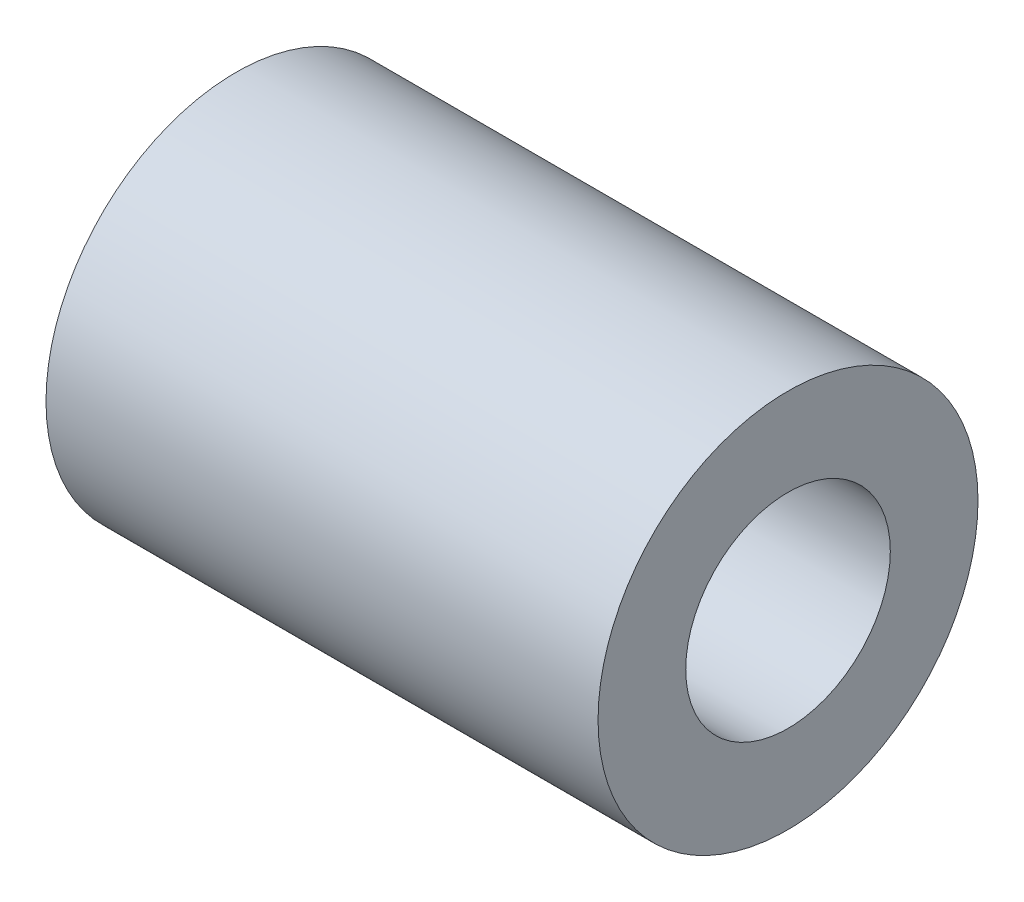
from build123d import *

# Parameters (mm, degrees)
SKETCH1_R           = 5.85
SKETCH1_R_2         = 3.15
BOSS_EXTRUDE1_DEPTH = 17


with BuildPart() as part:
    # Sketch1 → Boss-Extrude1 (new body)
    with BuildSketch(Plane(origin=(0, 0, 0), x_dir=(0, 0, -1), z_dir=(1, 0, 0))):
        Circle(SKETCH1_R)
        Circle(SKETCH1_R_2, mode=Mode.SUBTRACT)
    extrude(amount=BOSS_EXTRUDE1_DEPTH)


solid = part.part
